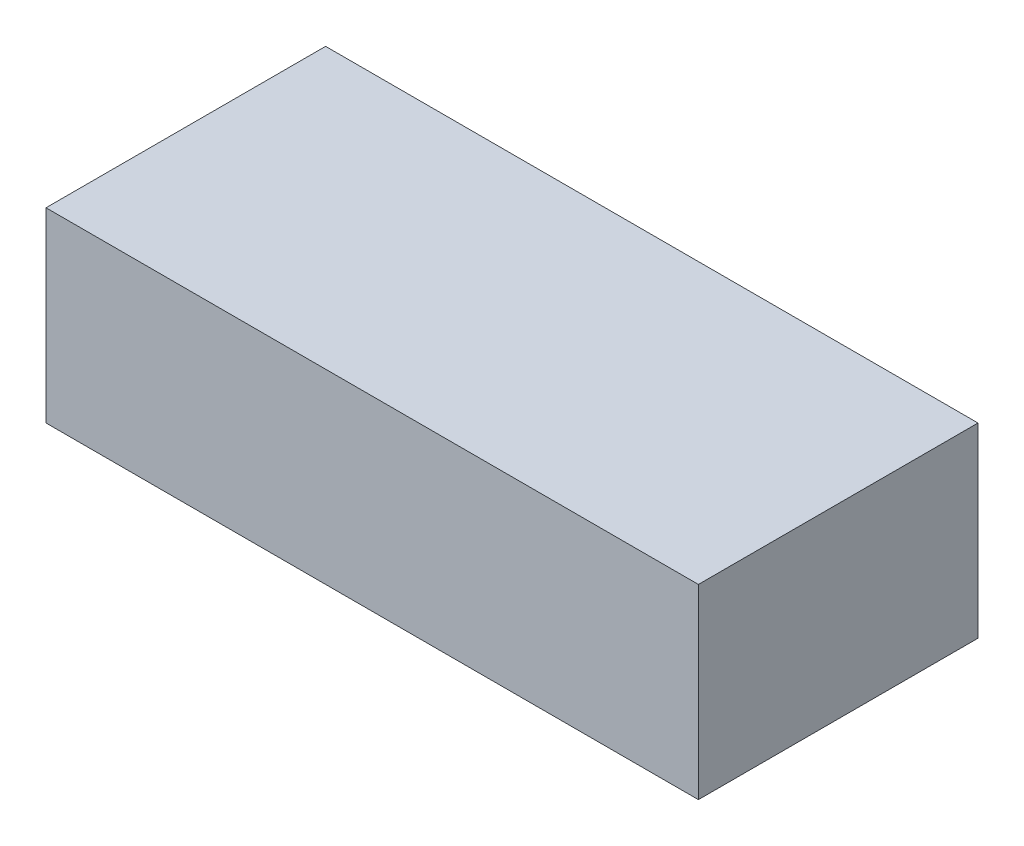
from build123d import *

# Parameters (mm, degrees)
SKETCH_1_W      = 28
SKETCH_1_H      = 12
EXTRUDE_1_DEPTH = 8


with BuildPart() as part:
    # 草图1 → 凸台-拉伸1 (new body)
    with BuildSketch(Plane(origin=(0, 0, 0), x_dir=(1, 0, 0), z_dir=(0, 1, 0))):
        Rectangle(SKETCH_1_W, SKETCH_1_H)
    extrude(amount=EXTRUDE_1_DEPTH)


solid = part.part
